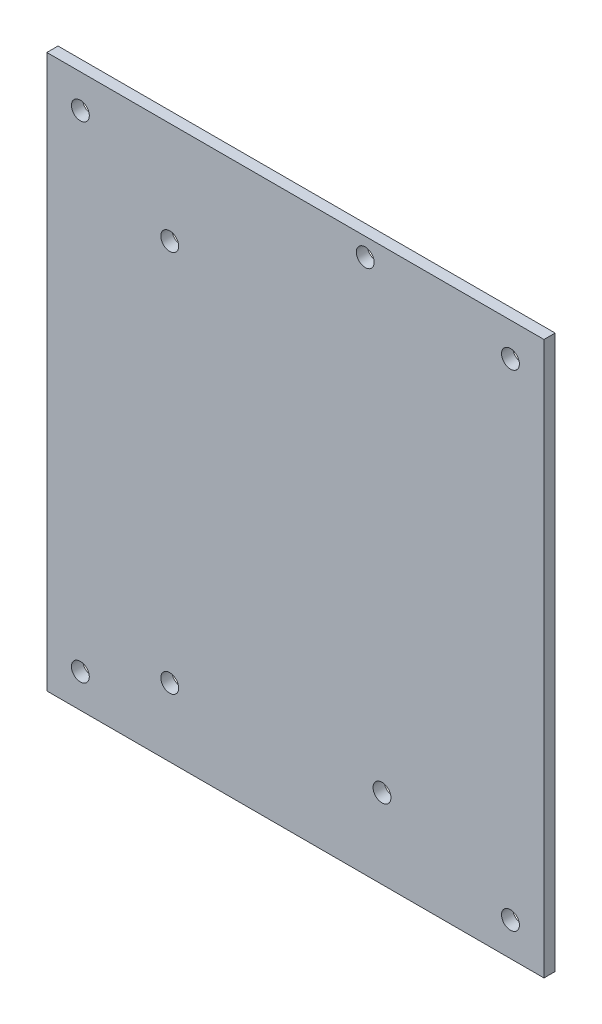
from build123d import *

# Parameters (mm, degrees)
SKETCH1_W           = 89
SKETCH1_H           = 99
BOSS_EXTRUDE1_DEPTH = 2
SKETCH2_R           = 1.6
CUT_EXTRUDE1_DEPTH  = 84.475926876
SKETCH3_R           = 1.6
CUT_EXTRUDE2_DEPTH  = 84.475926876


with BuildPart() as part:
    # Sketch1 → Boss-Extrude1 (new body)
    with BuildSketch(Plane.XY):
        with Locations((6.61978802, 16.462092452)):
            Rectangle(SKETCH1_W, SKETCH1_H)
    extrude(amount=BOSS_EXTRUDE1_DEPTH)

    # Sketch2 → Cut-Extrude1 (cut, through all)
    with BuildSketch(Plane.XY.offset(2)):
        with Locations((-31.88021198, 59.962092452)):
            Circle(SKETCH2_R)
        with Locations((45.11978802, 59.962092452)):
            Circle(SKETCH2_R)
        with Locations((-31.88021198, -27.037907548)):
            Circle(SKETCH2_R)
        with Locations((45.11978802, -27.037907548)):
            Circle(SKETCH2_R)
    extrude(amount=-CUT_EXTRUDE1_DEPTH, mode=Mode.SUBTRACT)

    # Sketch3 → Cut-Extrude2 (cut, through all)
    with BuildSketch(Plane.XY.offset(2)):
        with Locations((-15.88021198, 47.712092452)):
            Circle(SKETCH3_R)
        with Locations((-15.88021198, -20.787907548)):
            Circle(SKETCH3_R)
        with Locations((19.11978802, 62.712092452)):
            Circle(SKETCH3_R)
        with Locations((22.11978802, -18.787907548)):
            Circle(SKETCH3_R)
    extrude(amount=-CUT_EXTRUDE2_DEPTH, mode=Mode.SUBTRACT)


solid = part.part
